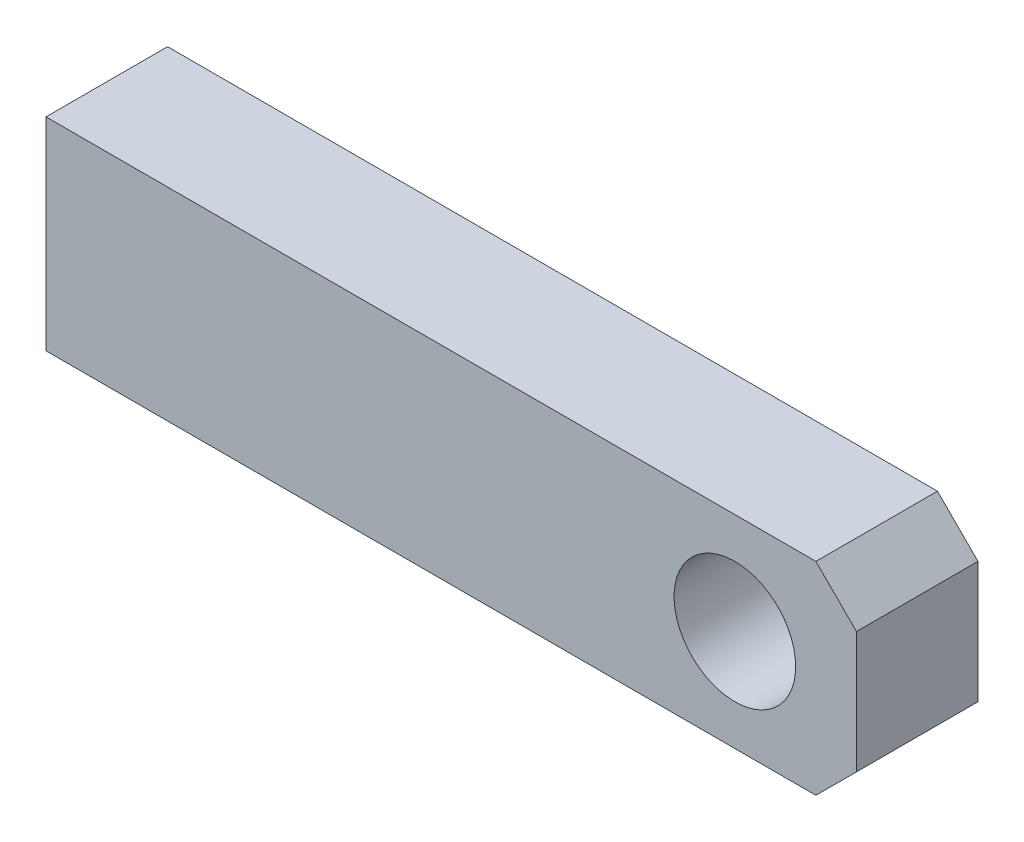
from build123d import *

# Parameters (mm, degrees)
SKETCH_1_W          = 20
SKETCH_1_H          = 5
EXTRUDE_1_DEPTH     = 3
SKETCH_2_R          = 1.5
CUT_EXTRUDE_1_DEPTH = 3
CHAMFER_1_SIZE      = 1
CHAMFER_2_SIZE      = 1


with BuildPart() as part:
    # 草图1 → 凸台-拉伸1 (new body)
    with BuildSketch(Plane.XY):
        with Locations((-6.4536035, -0.430232558)):
            Rectangle(SKETCH_1_W, SKETCH_1_H)
    extrude(amount=EXTRUDE_1_DEPTH)

    # 草图2 → 切除-拉伸1 (cut)
    with BuildSketch(Plane.XY.offset(3)):
        with Locations((0.5463965, -0.430232558)):
            Circle(SKETCH_2_R)
    extrude(amount=-CUT_EXTRUDE_1_DEPTH, mode=Mode.SUBTRACT)

    # 倒角1
    chamfer_1_edges = [part.edges().sort_by_distance(p)[0] for p in [
        (3.5463965, -2.930232558, 1.5),
    ]]
    chamfer(chamfer_1_edges, length=CHAMFER_1_SIZE)

    # 倒角2
    chamfer_2_edges = [part.edges().sort_by_distance(p)[0] for p in [
        (3.5463965, 2.069767442, 1.5),
    ]]
    chamfer(chamfer_2_edges, length=CHAMFER_2_SIZE)


solid = part.part
